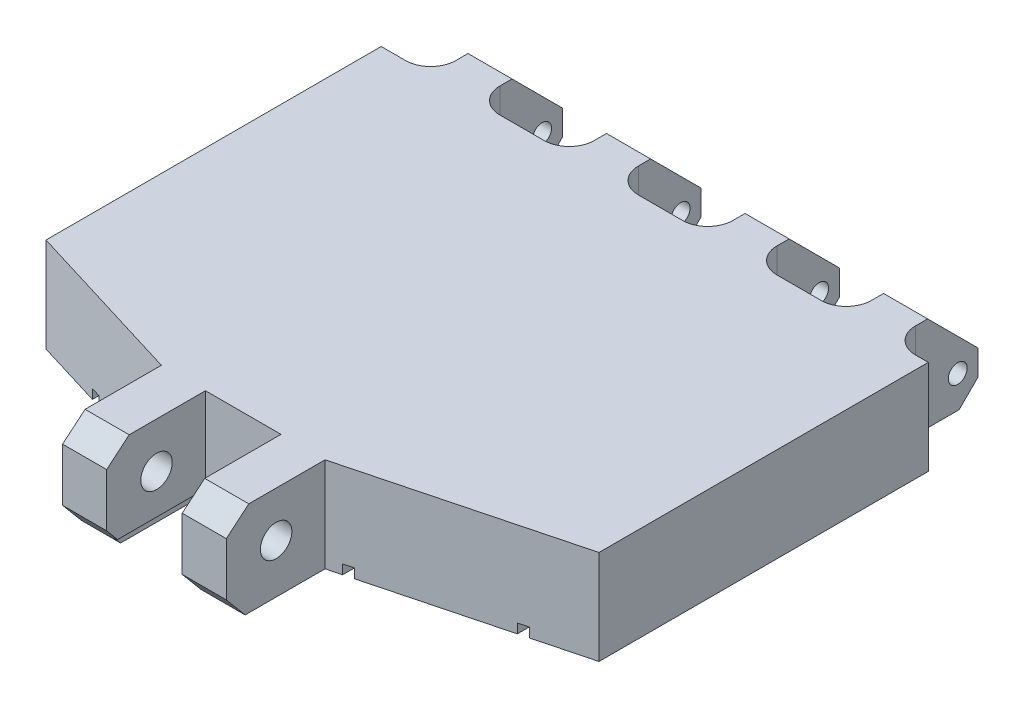
from build123d import *
from OCP.BRepFilletAPI import BRepFilletAPI_MakeChamfer

# Parameters (mm, degrees)
EXTRUDE_1_DEPTH       = 15
SKETCH_2_W            = 12
SKETCH_2_H            = 31.380738368
CUT_EXTRUDE_2_DEPTH   = 78.211371281
CHAMFER_1_SIZE        = 3
CHAMFER_1_SIZE2       = 3.575260778
SKETCH_4_R            = 2.5
CUT_EXTRUDE_3_DEPTH   = 86.823049672
SKETCH_8_R            = 1.5
CUT_EXTRUDE_3_2_DEPTH = 100.757006451
CUT_EXTRUDE_4_DEPTH   = 100.757006451
SKETCH_11_W           = 1.5
SKETCH_11_H           = 83.943010544
SKETCH_11_H_2         = 90.462059893
CUT_EXTRUDE_6_DEPTH   = 1.5
FILLET_7_R            = 4


with BuildPart() as part:
    # Эскиз1 → Вытянуть1 (new body)
    with BuildSketch(Plane(origin=(0, 0, 0), x_dir=(1, 0, 0), z_dir=(0, 1, 0))):
        Polygon((-39.391292545, -35), (47.5, -35), (47.5, 41.994456138), (41.467636093, 41.994456138), (41.467636093, 58.994456138), (34.467636093, 58.994456138), (34.467636093, 41.994456138), (19.467636417, 41.994456138), (19.467636417, 58.994456138), (12.467636275, 58.994456138), (12.467636275, 41.994456138), (-2.532363543, 41.994456138), (-2.532363543, 58.994456138), (-9.532363543, 58.994456138), (-9.532363543, 41.994456138), (-24.532363361, 41.994456138), (-24.532363361, 58.994456138), (-31.532363503, 58.994456138), (-31.532363503, 41.994456138), (-39.391292545, 41.994456138), align=None)
    extrude(amount=EXTRUDE_1_DEPTH)

    # Эскиз2 → Вытянуть2 (cut, through all)
    with BuildSketch(Plane(origin=(0, 15, 0), x_dir=(1, 0, 0), z_dir=(0, 1, 0))):
        with Locations((0, -35)):
            Rectangle(SKETCH_2_W, SKETCH_2_H)
        Polygon((-40.282255649, -10.968321), (-13, -19.309630816), (-13, -35), (-40.282255649, -35), align=None)
        Polygon((49.575798338, -35), (13, -35), (13, -19.309630816), (49.575798338, -9.764075531), align=None)
    extrude(amount=-CUT_EXTRUDE_2_DEPTH, mode=Mode.SUBTRACT)

    # Фаска1: one chamfer whose edges measure the first distance from different faces: ONE call of the kernel's chamfer builder (chamfer() names one face for all edges)
    chamfer_1_edges_1 = [part.edges().sort_by_distance(p)[0] for p in [
        (9.5, 0, 35),
        (-9.5, 0, 35),
    ]]
    chamfer_1_side_1 = [part.faces().sort_by_distance(p)[0] for p in [
        (3.754326558, 0, -14.37188085),
    ]]
    chamfer_1_edges_2 = [part.edges().sort_by_distance(p)[0] for p in [
        (9.5, 15, 35),
    ]]
    chamfer_1_side_2 = [part.faces().sort_by_distance(p)[0] for p in [
        (9.5, 7.5, 35),
    ]]
    chamfer_1_edges_3 = [part.edges().sort_by_distance(p)[0] for p in [
        (-9.5, 15, 35),
    ]]
    chamfer_1_side_3 = [part.faces().sort_by_distance(p)[0] for p in [
        (-9.5, 7.5, 35),
    ]]
    chamfer_1 = BRepFilletAPI_MakeChamfer(part.part.solid().wrapped)
    for e in chamfer_1_edges_1:
        chamfer_1.Add(CHAMFER_1_SIZE, CHAMFER_1_SIZE2, e.wrapped, chamfer_1_side_1[0].wrapped)  # the first distance lies on this face
    for e in chamfer_1_edges_2:
        chamfer_1.Add(CHAMFER_1_SIZE, CHAMFER_1_SIZE2, e.wrapped, chamfer_1_side_2[0].wrapped)  # the first distance lies on this face
    for e in chamfer_1_edges_3:
        chamfer_1.Add(CHAMFER_1_SIZE, CHAMFER_1_SIZE2, e.wrapped, chamfer_1_side_3[0].wrapped)  # the first distance lies on this face
    add(Compound.cast(chamfer_1.Shape()), mode=Mode.REPLACE)

    # Эскиз4 → Cut-Extrude 3 (cut, through all)
    with BuildSketch(Plane.ZY.offset(13)):
        with Locations((27.080154825, 7.787630389)):
            Circle(SKETCH_4_R)
    extrude(amount=-CUT_EXTRUDE_3_DEPTH, mode=Mode.SUBTRACT)

    # Эскиз8 → Cut-Extrude 3 2 (cut, through all)
    with BuildSketch(Plane.ZY.offset(31.532363503)):
        with Locations((-52.695808176, 5.099933888)):
            Circle(SKETCH_8_R)
    extrude(amount=-CUT_EXTRUDE_3_2_DEPTH, mode=Mode.SUBTRACT)

    # Эскиз9 → Вырез-Вытянуть4 (cut, through all)
    with BuildSketch(Plane.ZY.offset(31.532363503)):
        Polygon((-47.921961808, 15), (-55.921789721, 7.000172087), (-55.921789721, 3.000172087), (-52.921609925, -7.709e-06), (-58.994456138, -7.709e-06), (-58.994456138, 15), align=None)
    extrude(amount=-CUT_EXTRUDE_4_DEPTH, mode=Mode.SUBTRACT)

    # Эскиз11 → Вырез-Вытянуть6 (cut)
    with BuildSketch(Plane.XZ):
        with Locations((37.967637049, -4.77082371)):
            Rectangle(SKETCH_11_W, SKETCH_11_H)
        with Locations((-6.032362804, -4.77082371)):
            Rectangle(SKETCH_11_W, SKETCH_11_H)
        with Locations((15.967637122, -1.511299036)):
            Rectangle(SKETCH_11_W, SKETCH_11_H_2)
        with Locations((-28.032362511, -1.511299036)):
            Rectangle(SKETCH_11_W, SKETCH_11_H_2)
    extrude(amount=-CUT_EXTRUDE_6_DEPTH, mode=Mode.SUBTRACT)

    # Скругление7
    fillet_7_edges = [part.edges().sort_by_distance(p)[0] for p in [
        (41.467636093, 7.5, -41.994456138),
        (34.467636093, 7.5, -41.994456138),
        (19.467636417, 7.5, -41.994456138),
        (12.467636275, 7.5, -41.994456138),
        (-2.532363543, 7.5, -41.994456138),
        (-9.532363543, 7.5, -41.994456138),
        (-24.532363361, 7.5, -41.994456138),
        (-31.532363503, 7.5, -41.994456138),
    ]]
    fillet(fillet_7_edges, radius=FILLET_7_R)


solid = part.part
